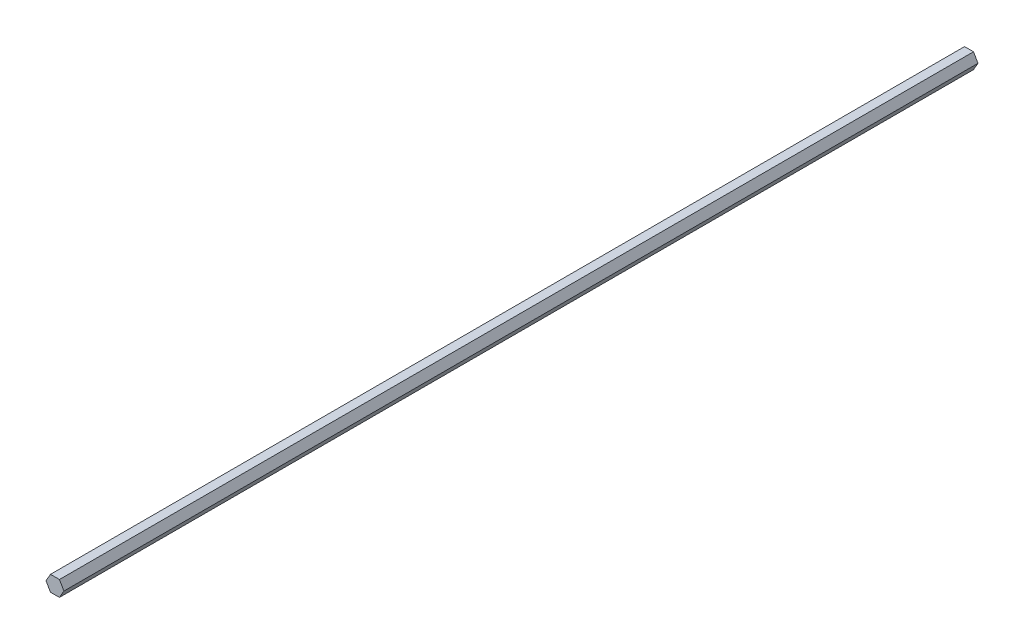
from build123d import *

# Parameters (mm, degrees)
EXTRUDE_1_DEPTH = 750


with BuildPart() as part:
    # 草图1 → 凸台-拉伸1 (new body)
    with BuildSketch(Plane.XY):
        Polygon((-18.684969359, 22.385617151), (-22.362690573, 28.755617151), (-29.718133003, 28.755617151), (-33.395854218, 22.385617151), (-29.718133003, 16.015617151), (-22.362690573, 16.015617151), align=None)
    extrude(amount=EXTRUDE_1_DEPTH)


solid = part.part
